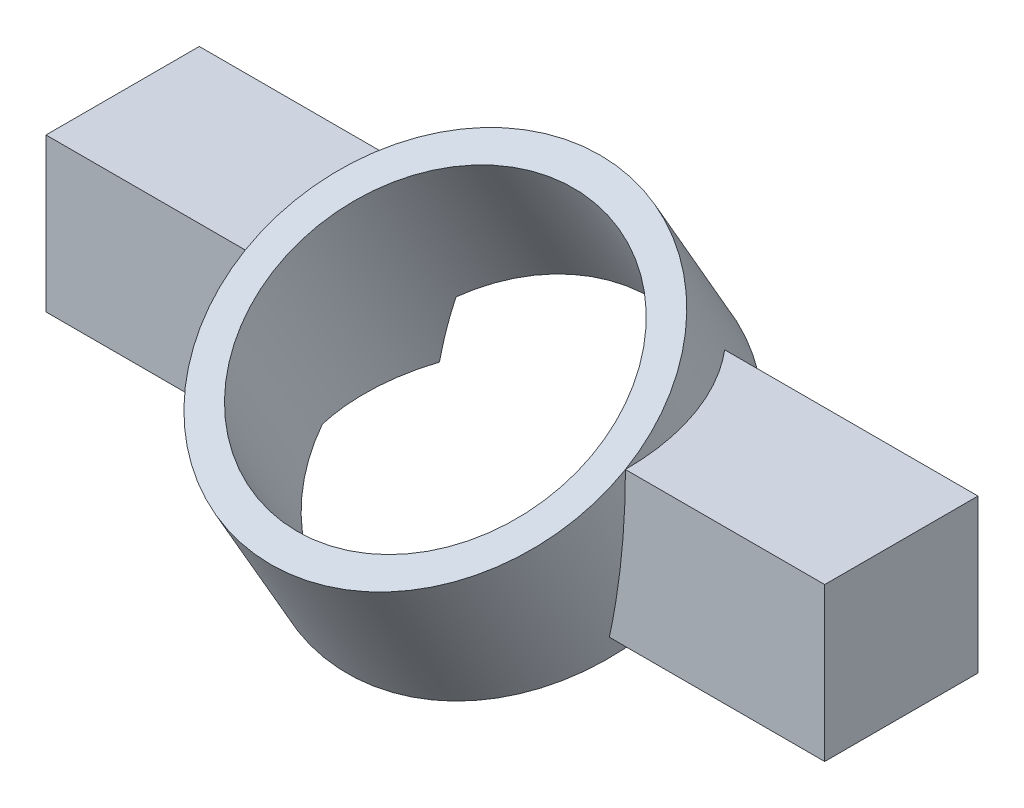
from build123d import *

# Parameters (mm, degrees)
SKETCH1_W           = 25.4
SKETCH1_H           = 5
BOSS_EXTRUDE1_DEPTH = 5
SKETCH4_R           = 6.2
SKETCH4_R_2         = 5.2
BOSS_EXTRUDE2_DEPTH = 5
SKETCH5_R           = 5.2
CUT_EXTRUDE1_DEPTH  = 27.514083203


with BuildPart() as part:
    # Sketch1 → Boss-Extrude1 (new body)
    with BuildSketch(Plane(origin=(0, 0, 0), x_dir=(1, 0, 0), z_dir=(0, 1, 0))):
        with Locations((-11.05106383, 2.5)):
            Rectangle(SKETCH1_W, SKETCH1_H)
    extrude(amount=BOSS_EXTRUDE1_DEPTH)

    # Sketch4 → Boss-Extrude2 (add)
    with BuildSketch(Plane(origin=(0, 3.75, 2.165063509), x_dir=(1, 0, 0), z_dir=(0, 0.866025403784438, 0.500000000000001))):
        with Locations((-11.05106383, 2.5)):
            Circle(SKETCH4_R)
        with Locations((-11.05106383, 2.5)):
            Circle(SKETCH4_R_2, mode=Mode.SUBTRACT)
    extrude(amount=-BOSS_EXTRUDE2_DEPTH)

    # Sketch5 → Cut-Extrude1 (cut, through all)
    with BuildSketch(Plane(origin=(0, 3.75, 2.165063509), x_dir=(1, 0, 0), z_dir=(0, 0.866025403784438, 0.500000000000001))):
        with Locations((-11.05106383, 2.5)):
            Circle(SKETCH5_R)
    extrude(amount=-CUT_EXTRUDE1_DEPTH, mode=Mode.SUBTRACT)


solid = part.part
